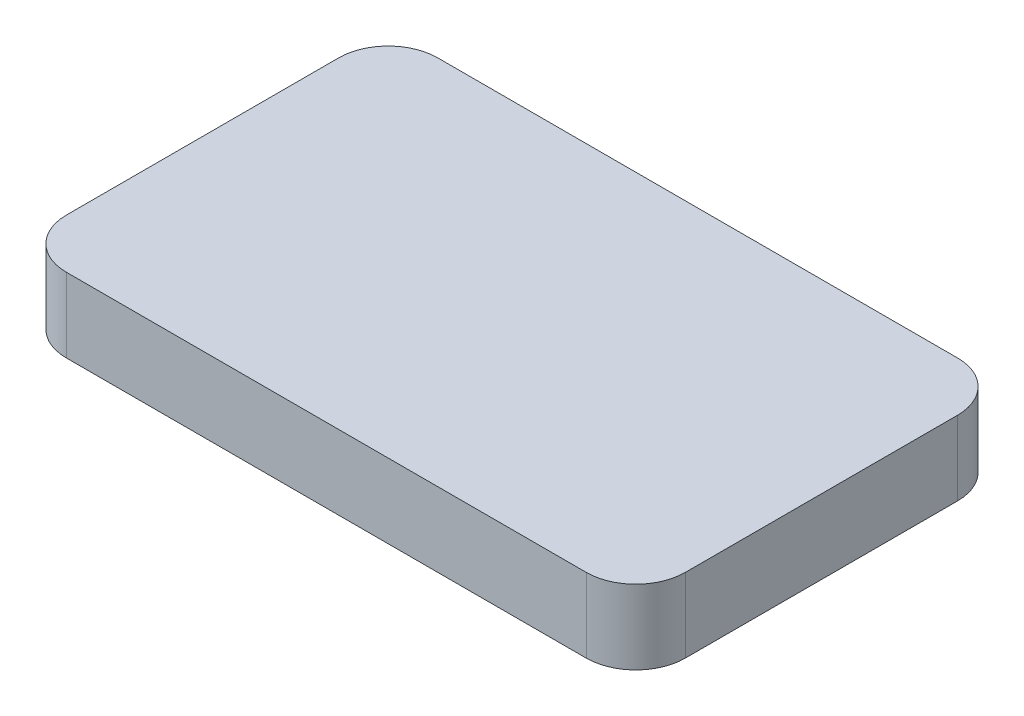
from build123d import *

# Parameters (mm, degrees)
SKETCH2_W           = 25
SKETCH2_H           = 15
BOSS_EXTRUDE1_DEPTH = 3
FILLET1_R           = 2


with BuildPart() as part:
    # Sketch2 → Boss-Extrude1 (new body)
    with BuildSketch(Plane(origin=(0, 0, 0), x_dir=(1, 0, 0), z_dir=(0, 1, 0))):
        Rectangle(SKETCH2_W, SKETCH2_H)
    extrude(amount=BOSS_EXTRUDE1_DEPTH)

    # Fillet1
    fillet1_edges = [part.edges().sort_by_distance(p)[0] for p in [
        (12.5, 1.5, 7.5),
        (-12.5, 1.5, 7.5),
        (-12.5, 1.5, -7.5),
        (12.5, 1.5, -7.5),
    ]]
    fillet(fillet1_edges, radius=FILLET1_R)


solid = part.part
